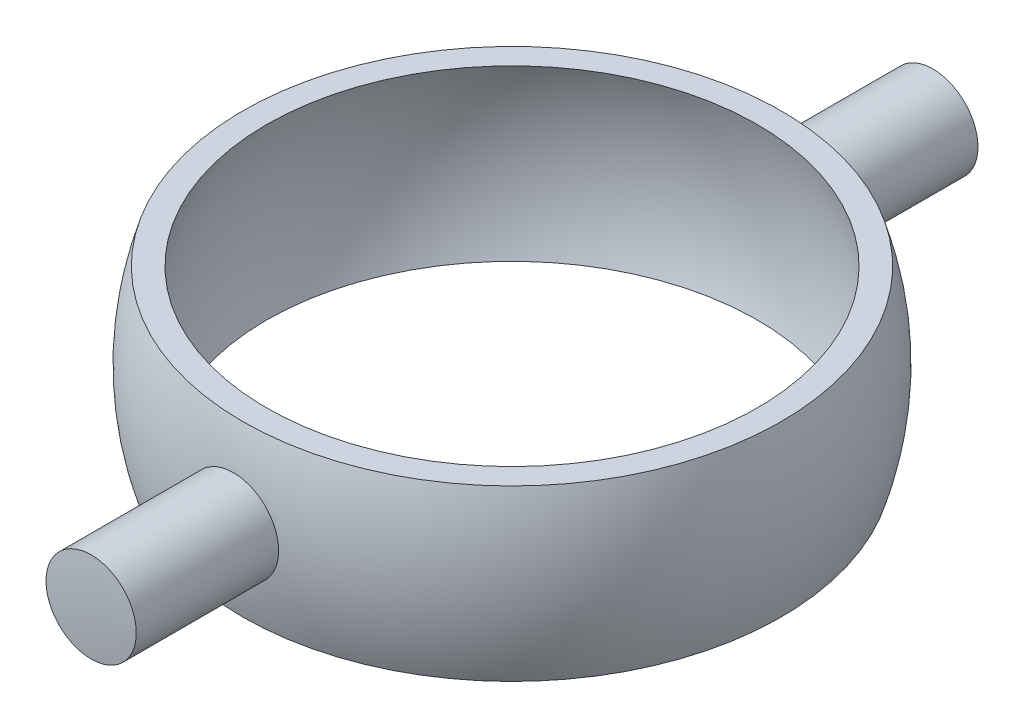
from build123d import *

# Parameters (mm, degrees)
BOSS_EXTRUDE1_REACH      = 69.731
BOSS_EXTRUDE1_END_RADIUS = 25
SKETCH3_R                = 4


with BuildPart() as part:
    # Sketch1 → Revolve1 (revolve)
    with BuildSketch(Plane.XY):
        with BuildLine():
            Line((-23.848480035, 7.5), (-21.742814905, 7.5))
            ThreePointArc((-21.742814905, 7.5), (-23, 0), (-21.742814905, -7.5))
            Line((-21.742814905, -7.5), (-23.848480035, -7.5))
            ThreePointArc((-23.848480035, -7.5), (-25, 0), (-23.848480035, 7.5))
        make_face()
    revolve(axis=Axis((0, 8.856055312, 0), (0, -1, 0)))

    # Boss-Extrude1: up to this sphere (the profile starts outside it)
    boss_extrude1_end = Location((0, 0, 0)) * Sphere(BOSS_EXTRUDE1_END_RADIUS, mode=Mode.PRIVATE)
    # Sketch3 → Boss-Extrude1 (add, up to the surface)
    with BuildSketch(Plane.XY.offset(37.5), mode=Mode.PRIVATE) as boss_extrude1_sk1:
        Circle(SKETCH3_R)
    boss_extrude1_tool1 = extrude(boss_extrude1_sk1.sketch, amount=-BOSS_EXTRUDE1_REACH, mode=Mode.PRIVATE) - boss_extrude1_end
    boss_extrude1 = boss_extrude1_tool1.solids().sort_by_distance((0, 0, 37.5))[0]
    add(boss_extrude1)

    # Mirror1: Boss-Extrude1 across plane
    add(boss_extrude1.mirror(Plane.XY))

    # Sketch4 → Cut-Revolve1 (revolve, cut)
    with BuildSketch(Plane(origin=(0, 0, 0), x_dir=(0, 0, -1), z_dir=(1, 0, 0))):
        with BuildLine():
            Line((0, 40), (0, 37.5))
            ThreePointArc((0, 37.5), (-37.5, 0), (0, -37.5))
            Line((0, -37.5), (0, -40))
            ThreePointArc((0, -40), (-40, 0), (0, 40))
        make_face()
    revolve(axis=Axis((0, -37.5, 0), (0, -1, 0)), mode=Mode.SUBTRACT)


solid = part.part
